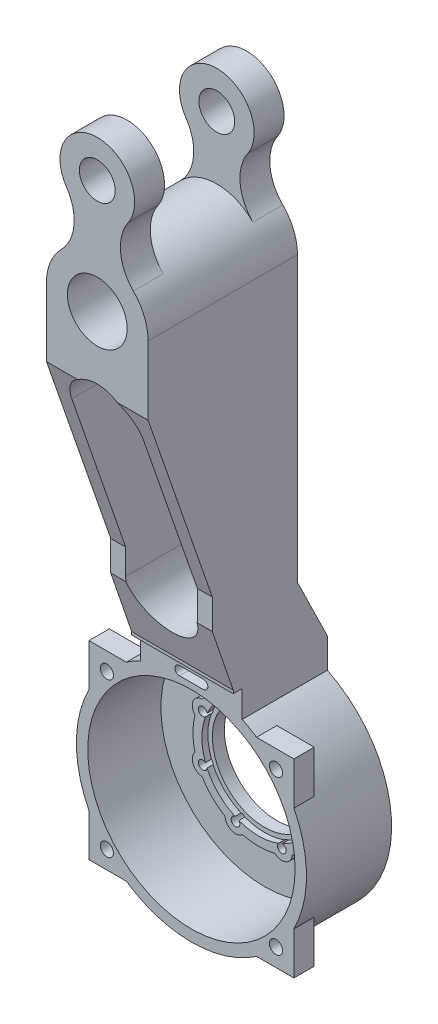
from build123d import *

# Parameters (mm, degrees)
SKETCH1_R                = 17.5
SKETCH1_R_2              = 1.45
FRONTPANEL_DEPTH         = 4
SKETCH1_3_R              = 34.7
SIDEWALLS_DEPTH          = 28.5
SKETCH2_R                = 19
MOTORSPACER_DEPTH        = 2
SKETCH1_5_R              = 1.45
MOTORMOUNTINGHOLES_DEPTH = 6
BOSS_EXTRUDE7_START      = -6.8
BOSS_EXTRUDE7_DEPTH      = 6.8
SKETCH3_5_R              = 2.2
CUT_EXTRUDE2_DEPTH       = 6
CUT_EXTRUDE8_DEPTH       = 65.705100263
SKETCH11_W               = 34
SKETCH11_H               = 28.5
BOSS_EXTRUDE8_DEPTH      = 10
SKETCH14_W               = 34
SKETCH14_H               = 31.5
BOSS_EXTRUDE9_DEPTH      = 1
CUT_EXTRUDE11_DEPTH      = 1
CUT_EXTRUDE11_DEPTH_BACK = 16
SKETCH19_R               = 10
SKETCH19_R_2             = 6
BOSS_EXTRUDE10_DEPTH     = 50
CUT_EXTRUDE12_REACH      = 227.811
CUT_EXTRUDE14_START      = -5
CUT_EXTRUDE14_DEPTH      = 215.755546028
CUT_EXTRUDE15_START      = -10
SKETCH19_6_R             = 6
CUT_EXTRUDE15_DEPTH      = 30


with BuildPart() as part:
    # Sketch1 → FrontPanel (new body)
    with BuildSketch(Plane.XY):
        with BuildLine():
            Line((-17, 34.543450899), (-17, 43.5))
            Line((-17, 43.5), (17, 43.5))
            Line((17, 43.5), (17, 34.543450899))
            ThreePointArc((17, 34.543450899), (0, -38.5), (-17, 34.543450899))
        make_face()
        Circle(SKETCH1_R, mode=Mode.SUBTRACT)
        with Locations((-7.749339505, 18.708560533)):
            Circle(SKETCH1_R_2, mode=Mode.SUBTRACT)
        with Locations((7.749339505, 18.708560533)):
            Circle(SKETCH1_R_2, mode=Mode.SUBTRACT)
        with Locations((18.708560533, 7.749339505)):
            Circle(SKETCH1_R_2, mode=Mode.SUBTRACT)
        with Locations((18.708560533, -7.749339505)):
            Circle(SKETCH1_R_2, mode=Mode.SUBTRACT)
        with Locations((7.749339505, -18.708560533)):
            Circle(SKETCH1_R_2, mode=Mode.SUBTRACT)
        with Locations((-7.749339505, -18.708560533)):
            Circle(SKETCH1_R_2, mode=Mode.SUBTRACT)
        with Locations((-18.708560533, -7.749339505)):
            Circle(SKETCH1_R_2, mode=Mode.SUBTRACT)
        with Locations((-18.708560533, 7.749339505)):
            Circle(SKETCH1_R_2, mode=Mode.SUBTRACT)
    extrude(amount=FRONTPANEL_DEPTH)

    # Sketch1<3> → SideWalls (add)
    with BuildSketch(Plane.XY):
        with BuildLine():
            Line((-17, 34.543450899), (-17, 43.5))
            Line((-17, 43.5), (17, 43.5))
            Line((17, 43.5), (17, 34.543450899))
            ThreePointArc((17, 34.543450899), (0, -38.5), (-17, 34.543450899))
        make_face()
        with Locations(Location((0, 0, 0), (0, 0, 180))):
            Circle(SKETCH1_3_R, mode=Mode.SUBTRACT)
    extrude(amount=SIDEWALLS_DEPTH)

    # Sketch2 → MotorSpacer (add)
    with BuildSketch(Plane.XY.offset(4)):
        with BuildLine():
            ThreePointArc((-5.4209, 21.321675431), (-9.088731519, 21.942138897), (-11.243546134, 18.909856434))
            ThreePointArc((-11.243546134, 18.909856434), (-15.556349186, 15.556349186), (-18.909856434, 11.243546134))
            ThreePointArc((-18.909856434, 11.243546134), (-21.942138897, 9.088731519), (-21.321675431, 5.4209))
            ThreePointArc((-21.321675431, 5.4209), (-22, 0), (-21.321675431, -5.4209))
            ThreePointArc((-21.321675431, -5.4209), (-21.942138897, -9.088731519), (-18.909856434, -11.243546134))
            ThreePointArc((-18.909856434, -11.243546134), (-15.556349186, -15.556349186), (-11.243546134, -18.909856434))
            ThreePointArc((-11.243546134, -18.909856434), (-9.088731519, -21.942138897), (-5.4209, -21.321675431))
            ThreePointArc((-5.4209, -21.321675431), (0, -22), (5.4209, -21.321675431))
            ThreePointArc((5.4209, -21.321675431), (9.088731519, -21.942138897), (11.243546134, -18.909856434))
            ThreePointArc((11.243546134, -18.909856434), (15.556349186, -15.556349186), (18.909856434, -11.243546134))
            ThreePointArc((18.909856434, -11.243546134), (21.942138897, -9.088731519), (21.321675431, -5.4209))
            ThreePointArc((21.321675431, -5.4209), (22, 0), (21.321675431, 5.4209))
            ThreePointArc((21.321675431, 5.4209), (21.942138897, 9.088731519), (18.909856434, 11.243546134))
            ThreePointArc((18.909856434, 11.243546134), (15.556349186, 15.556349186), (11.243546134, 18.909856434))
            ThreePointArc((11.243546134, 18.909856434), (9.088731519, 21.942138897), (5.4209, 21.321675431))
            ThreePointArc((5.4209, 21.321675431), (0, 22), (-5.4209, 21.321675431))
        make_face()
        with Locations(Location((0, 0, 0), (0, 0, 159.646622112))):
            Circle(SKETCH2_R, mode=Mode.SUBTRACT)
    extrude(amount=MOTORSPACER_DEPTH)

    # Sketch1<5> → MotorMountingHoles (cut)
    with BuildSketch(Plane.XY):
        with Locations(Location((-7.749339505, 18.708560533, 0), (0, 0, 263.105901259))):
            Circle(SKETCH1_5_R)
        with Locations(Location((7.749339505, 18.708560533, 0), (0, 0, 218.105901259))):
            Circle(SKETCH1_5_R)
        with Locations(Location((18.708560533, 7.749339505, 0), (0, 0, 173.105901259))):
            Circle(SKETCH1_5_R)
        with Locations(Location((18.708560533, -7.749339505, 0), (0, 0, 186.894098741))):
            Circle(SKETCH1_5_R)
        with Locations(Location((7.749339505, -18.708560533, 0), (0, 0, 141.894098741))):
            Circle(SKETCH1_5_R)
        with Locations(Location((-7.749339505, -18.708560533, 0), (0, 0, 96.894098741))):
            Circle(SKETCH1_5_R)
        with Locations(Location((-18.708560533, -7.749339505, 0), (0, 0, 51.894098741))):
            Circle(SKETCH1_5_R)
        with Locations(Location((-18.708560533, 7.749339505, 0), (0, 0, 308.105901259))):
            Circle(SKETCH1_5_R)
    extrude(amount=MOTORMOUNTINGHOLES_DEPTH, mode=Mode.SUBTRACT)

    # Sketch3 → Boss-Extrude7 (add)
    with BuildSketch(Plane.XY.offset(28.5).offset(BOSS_EXTRUDE7_START)):
        with BuildLine():
            Line((-21.775846711, 31.75), (-34.3, 31.75))
            Line((-34.3, 31.75), (-34.3, 17.485994396))
            ThreePointArc((-34.3, 17.485994396), (-28.930790001, 25.401956419), (-21.775846711, 31.75))
        make_face()
        with BuildLine():
            Line((34.3, 17.485994396), (34.3, 31.75))
            Line((34.3, 31.75), (21.775846711, 31.75))
            ThreePointArc((21.775846711, 31.75), (28.930790001, 25.401956419), (34.3, 17.485994396))
        make_face()
        with BuildLine():
            Line((-34.3, -17.485994396), (-34.3, -31.75))
            Line((-34.3, -31.75), (-21.775846711, -31.75))
            ThreePointArc((-21.775846711, -31.75), (-28.930790001, -25.401956419), (-34.3, -17.485994396))
        make_face()
        with BuildLine():
            Line((21.775846711, -31.75), (34.3, -31.75))
            Line((34.3, -31.75), (34.3, -17.485994396))
            ThreePointArc((34.3, -17.485994396), (28.930790001, -25.401956419), (21.775846711, -31.75))
        make_face()
    extrude(amount=BOSS_EXTRUDE7_DEPTH)

    # Sketch3<5> → Cut-Extrude2 (cut)
    with BuildSketch(Plane.XY.offset(28.5)):
        with Locations((-28.3, 25.75)):
            Circle(SKETCH3_5_R)
        with Locations(Location((28.3, 25.75, 0), (0, 0, 180))):
            Circle(SKETCH3_5_R)
        with Locations(Location((-28.3, -25.75, 0), (0, 0, 180))):
            Circle(SKETCH3_5_R)
        with Locations((28.3, -25.75)):
            Circle(SKETCH3_5_R)
    extrude(amount=-CUT_EXTRUDE2_DEPTH, mode=Mode.SUBTRACT)

    # Sketch7 → Cut-Extrude8 (cut, through all)
    with BuildSketch(Plane.XY.offset(28.5)):
        with BuildLine():
            Line((-4, 39.7), (4, 39.7))
            ThreePointArc((4, 39.7), (5.5, 38.2), (4, 36.7))
            Line((4, 36.7), (-4, 36.7))
            ThreePointArc((-4, 36.7), (-5.5, 38.2), (-4, 39.7))
        make_face()
    extrude(amount=-CUT_EXTRUDE8_DEPTH, mode=Mode.SUBTRACT)

    # Sketch14 → Boss-Extrude9 (add)
    with BuildSketch(Plane(origin=(0, 43.5, 0), x_dir=(1, 0, 0), z_dir=(0, 1, 0))):
        with Locations((0, -15.75)):
            Rectangle(SKETCH14_W, SKETCH14_H)
    extrude(amount=BOSS_EXTRUDE9_DEPTH)



with BuildPart() as body_2:
    # Sketch11 → Boss-Extrude8 (new body)
    with BuildSketch(Plane(origin=(0, 65, 0), x_dir=(1, 0, 0), z_dir=(0, 1, 0))):
        with Locations((0, -24.25)):
            Rectangle(SKETCH11_W, SKETCH11_H)
    extrude(amount=BOSS_EXTRUDE8_DEPTH)


with BuildPart() as part_1:
    add(part.part)

    add(body_2.part)  # loft5 joins it to this body
    # loft from a face of the part (loft5)
    loft([part_1.faces().sort_by_distance((0, 44.5, 15.75))[0], part_1.faces().sort_by_distance((0, 65, 24.25))[0]])

    # Sketch9 → Cut-Extrude11 (cut, two sides: drawn at the far end of the back side and taken through both)
    with BuildSketch(Plane(origin=(0, 34.7, 0), x_dir=(-1, 0, 0), z_dir=(0, -1, 0)).offset(-CUT_EXTRUDE11_DEPTH_BACK)):
        Polygon((-6.5, 0), (6.5, 0), (8, -3.2), (6.5, -3.2), (6.5, -8), (-6.5, -8), (-6.5, -3.2), (-8, -3.2), align=None)
    extrude(amount=CUT_EXTRUDE11_DEPTH + CUT_EXTRUDE11_DEPTH_BACK, mode=Mode.SUBTRACT)

    # Sketch19 → Boss-Extrude10 (add)
    # profile 1 of 3: a face of its own
    with BuildSketch(Plane(origin=(0, 0, 10), x_dir=(-1, 0, 0), z_dir=(0, 0, -1))):
        with BuildLine():
            Line((-17, 160), (-17, 75))
            Line((-17, 75), (-12, 75))
            Line((-12, 75), (-12, 127))
            ThreePointArc((-12, 127), (0, 139), (12, 127))
            Line((12, 127), (12, 75))
            Line((12, 75), (17, 75))
            Line((17, 75), (17, 160))
            ThreePointArc((17, 160), (15.720882745, 166.469454824), (12.076018151, 171.96535773))
            ThreePointArc((12.076018151, 171.96535773), (0, 177), (-12.076018151, 171.96535773))
            ThreePointArc((-12.076018151, 171.96535773), (-15.720882745, 166.469454824), (-17, 160))
        make_face()
        with Locations((0, 160)):
            Circle(SKETCH19_R, mode=Mode.SUBTRACT)
    # profile 2 of 3: a face of its own
    with BuildSketch(Plane(origin=(0, 0, 10), x_dir=(-1, 0, 0), z_dir=(0, 0, -1))):
        with BuildLine():
            Line((-12, 127), (-12, 75))
            Line((-12, 75), (12, 75))
            Line((12, 75), (12, 127))
            ThreePointArc((12, 127), (0, 139), (-12, 127))
        make_face()
    # profile 3 of 3: a face of its own
    with BuildSketch(Plane(origin=(0, 0, 10), x_dir=(-1, 0, 0), z_dir=(0, 0, -1))):
        with BuildLine():
            ThreePointArc((-10.332421948, 190.965011962), (-7.794094957, 181.152238037), (-12.076018151, 171.96535773))
            ThreePointArc((-12.076018151, 171.96535773), (0, 177), (12.076018151, 171.96535773))
            ThreePointArc((12.076018151, 171.96535773), (7.794094957, 181.152238037), (10.332421948, 190.965011962))
            ThreePointArc((10.332421948, 190.965011962), (0, 210.5), (-10.332421948, 190.965011962))
        make_face()
        with Locations((0, 198)):
            Circle(SKETCH19_R_2, mode=Mode.SUBTRACT)
    extrude(amount=-BOSS_EXTRUDE10_DEPTH)

    # Sketch21 → Cut-Extrude12 (cut, up to next)
    with BuildSketch(Plane(origin=(17, 0, 0), x_dir=(0, 0, -1), z_dir=(1, 0, 0)), mode=Mode.PRIVATE) as cut_extrude12_sk1:
        Polygon((-38.5, 75), (-60, 75), (-60, 137), align=None)
    cut_extrude12_tool1 = extrude(cut_extrude12_sk1.sketch, amount=-CUT_EXTRUDE12_REACH, mode=Mode.PRIVATE) & part_1.part
    add(cut_extrude12_tool1.solids().sort_by_distance((17, 95.666667, 52.833333))[0], mode=Mode.SUBTRACT)

    # Sketch19<5> → Cut-Extrude14 (cut, through all)
    with BuildSketch(Plane(origin=(0, 0, 10), x_dir=(-1, 0, 0), z_dir=(0, 0, -1)).offset(CUT_EXTRUDE14_START)):
        with BuildLine():
            Line((-12, 127), (-12, 75))
            Line((-12, 75), (12, 75))
            Line((12, 75), (12, 127))
            ThreePointArc((12, 127), (0, 139), (-12, 127))
        make_face()
        with BuildLine():
            Line((12, 75), (-12, 75))
            Line((-12, 75), (-12, 66.5))
            ThreePointArc((-12, 66.5), (-11.976447111, 65.748525049), (-11.9058809, 65))
            Line((-11.9058809, 65), (11.9058809, 65))
            ThreePointArc((11.9058809, 65), (11.976447111, 65.748525049), (12, 66.5))
            Line((12, 66.5), (12, 75))
        make_face()
        with BuildLine():
            Line((11.9058809, 65), (-11.9058809, 65))
            ThreePointArc((-11.9058809, 65), (0, 54.5), (11.9058809, 65))
        make_face()
    extrude(amount=-CUT_EXTRUDE14_DEPTH, mode=Mode.SUBTRACT)

    # Sketch19<6> → Cut-Extrude15 (cut)
    with BuildSketch(Plane(origin=(0, 0, 10), x_dir=(-1, 0, 0), z_dir=(0, 0, -1)).offset(CUT_EXTRUDE15_START)):
        with BuildLine():
            ThreePointArc((-10.332421948, 190.965011962), (-7.794094957, 181.152238037), (-12.076018151, 171.96535773))
            ThreePointArc((-12.076018151, 171.96535773), (0, 177), (12.076018151, 171.96535773))
            ThreePointArc((12.076018151, 171.96535773), (7.794094957, 181.152238037), (10.332421948, 190.965011962))
            ThreePointArc((10.332421948, 190.965011962), (0, 210.5), (-10.332421948, 190.965011962))
        make_face()
        with Locations((0, 198)):
            Circle(SKETCH19_6_R, mode=Mode.SUBTRACT)
    extrude(amount=-CUT_EXTRUDE15_DEPTH, mode=Mode.SUBTRACT)


solid = part_1.part
